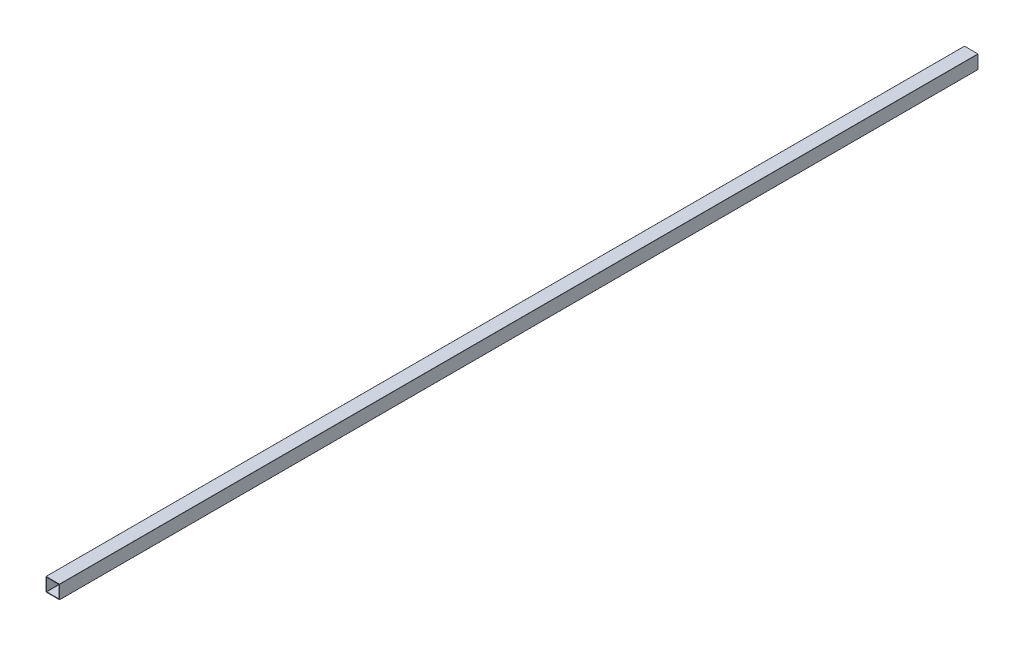
from build123d import *

# Parameters (mm, degrees)
CROQUIS1_W              = 88.9
CROQUIS1_H              = 88.9
CROQUIS1_W_2            = 81.3
CROQUIS1_H_2            = 81.3
SALIENTE_EXTRUIR1_DEPTH = 6000
REDONDEO1_R             = 1


with BuildPart() as part:
    # Croquis1 → Saliente-Extruir1 (new body)
    with BuildSketch(Plane.XY):
        Rectangle(CROQUIS1_W, CROQUIS1_H)
        Rectangle(CROQUIS1_W_2, CROQUIS1_H_2, mode=Mode.SUBTRACT)
    extrude(amount=-SALIENTE_EXTRUIR1_DEPTH)

    # Redondeo1
    redondeo1_edges = [part.edges().sort_by_distance(p)[0] for p in [
        (40.65, -40.65, -3000),
        (-40.65, -40.65, -3000),
        (-40.65, 40.65, -3000),
        (40.65, 40.65, -3000),
        (44.45, -44.45, -3000),
        (-44.45, -44.45, -3000),
        (-44.45, 44.45, -3000),
        (44.45, 44.45, -3000),
    ]]
    fillet(redondeo1_edges, radius=REDONDEO1_R)


solid = part.part
